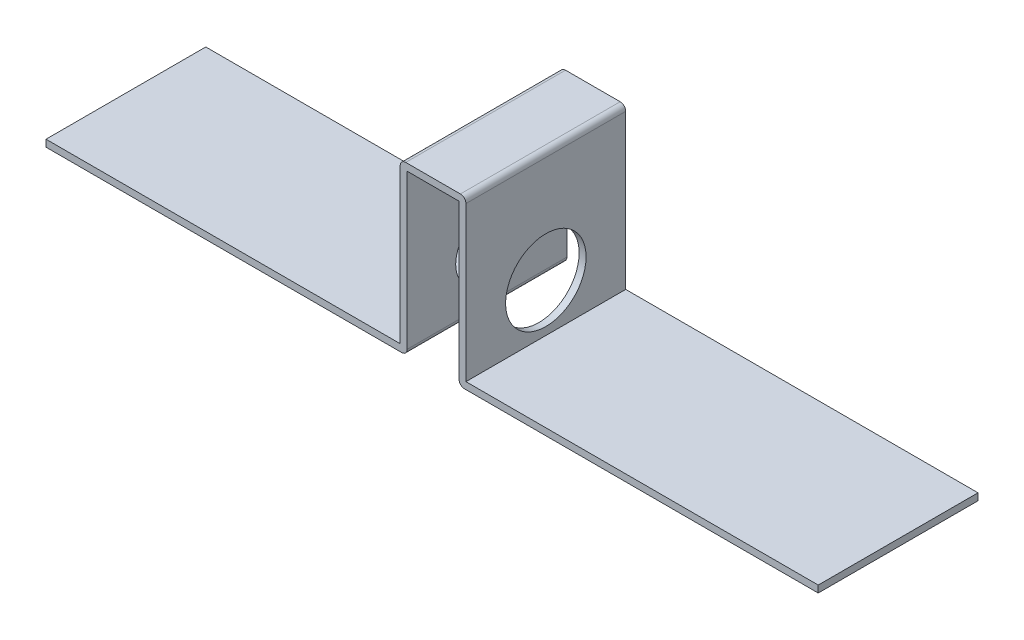
from build123d import *

# Parameters (mm, degrees)
BOSS_EXTRUDE1_DEPTH = 73.152
SKETCH2_R           = 14.351
CUT_EXTRUDE1_DEPTH  = 12.7
SKETCH3_R           = 18.415
CUT_EXTRUDE2_DEPTH  = 12.7
FILLET1_R           = 2.54


with BuildPart() as part:
    # Sketch1 → Boss-Extrude1 (new body)
    with BuildSketch(Plane.XY):
        Polygon((0, 0), (165.354, 0), (165.354, 73.152), (189.103, 73.152), (189.103, 0), (353.568, 0), (353.568, 3.175), (192.278, 3.175), (192.278, 76.327), (162.179, 76.327), (162.179, 3.175), (0, 3.175), align=None)
    extrude(amount=BOSS_EXTRUDE1_DEPTH)

    # Sketch2 → Cut-Extrude1 (cut)
    with BuildSketch(Plane.ZY.offset(-162.179)):
        with Locations((36.576, 25.146)):
            Circle(SKETCH2_R)
    extrude(amount=-CUT_EXTRUDE1_DEPTH, mode=Mode.SUBTRACT)

    # Sketch3 → Cut-Extrude2 (cut)
    with BuildSketch(Plane(origin=(192.278, 0, 0), x_dir=(0, 0, -1), z_dir=(1, 0, 0))):
        with Locations((-36.576, 25.146)):
            Circle(SKETCH3_R)
    extrude(amount=-CUT_EXTRUDE2_DEPTH, mode=Mode.SUBTRACT)

    # Fillet1
    fillet1_edges = [part.edges().sort_by_distance(p)[0] for p in [
        (162.179, 76.327, 36.576),
        (192.278, 76.327, 36.576),
        (189.103, 0, 36.576),
        (165.354, 0, 36.576),
    ]]
    fillet(fillet1_edges, radius=FILLET1_R)


solid = part.part
